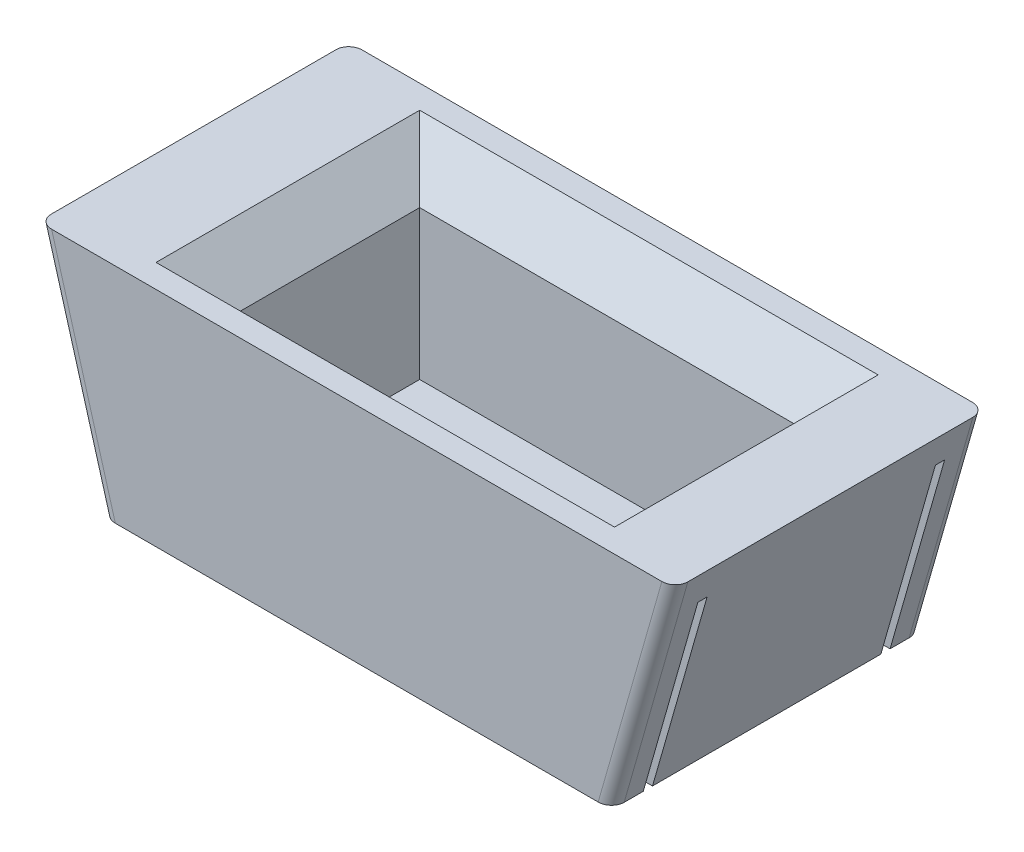
from build123d import *

# Parameters (mm, degrees)
SKETCH1_W           = 127
SKETCH1_H           = 61.9252
BOSS_EXTRUDE1_DEPTH = 44.45
SKETCH1_3_W         = 127
SKETCH1_3_H         = 1.8415
CUT_EXTRUDE2_DEPTH  = 38.1
SKETCH2_W           = 71.12
SKETCH2_H           = 32.258
SKETCH2_W_2         = 35.442647017
SKETCH2_H_2         = 23.182829488
CUT_EXTRUDE3_DEPTH  = 38.1
CHAMFER2_SIZE       = 10.16
CUT_EXTRUDE5_DEPTH  = 100.210800294
FILLET3_R           = 2.54
SKETCH2_3_W         = 35.442647017
SKETCH2_3_H         = 23.182829488
CUT_EXTRUDE6_DEPTH  = 84.466970107
CHAMFER3_SIZE       = 2.54
SKETCH9_W           = 74.62
SKETCH9_H           = 35.758
CUT_EXTRUDE7_DEPTH  = 38.1


with BuildPart() as part:
    # Sketch1 → Boss-Extrude1 (new body)
    with BuildSketch(Plane(origin=(0, 0, 0), x_dir=(1, 0, 0), z_dir=(0, 1, 0))):
        Rectangle(SKETCH1_W, SKETCH1_H)
    extrude(amount=BOSS_EXTRUDE1_DEPTH)

    # Sketch1<3> → Cut-Extrude2 (cut)
    with BuildSketch(Plane(origin=(0, 0, 0), x_dir=(1, 0, 0), z_dir=(0, 1, 0))):
        with Locations((0, 23.69185)):
            Rectangle(SKETCH1_3_W, SKETCH1_3_H)
        with Locations((0, -23.69185)):
            Rectangle(SKETCH1_3_W, SKETCH1_3_H)
    extrude(amount=CUT_EXTRUDE2_DEPTH, mode=Mode.SUBTRACT)

    # Sketch2 → Cut-Extrude3 (cut)
    with BuildSketch(Plane(origin=(0, 44.45, 0), x_dir=(1, 0, 0), z_dir=(0, 1, 0))):
        with Locations((1.016, 0)):
            Rectangle(SKETCH2_W, SKETCH2_H)
        with Locations((12.504676492, 0)):
            Rectangle(SKETCH2_W_2, SKETCH2_H_2, mode=Mode.SUBTRACT)
    extrude(amount=-CUT_EXTRUDE3_DEPTH, mode=Mode.SUBTRACT)

    # Chamfer2
    chamfer2_edges = [part.edges().sort_by_distance(p)[0] for p in [
        (36.576, 44.45, 0),
        (1.016, 44.45, -16.129),
        (-34.544, 44.45, 0),
        (1.016, 44.45, 16.129),
    ]]
    chamfer(chamfer2_edges, length=CHAMFER2_SIZE)

    # Sketch7 → Cut-Extrude5 (cut, through all)
    with BuildSketch(Plane.XY.offset(30.9626)):
        Polygon((-50.795476794, 0), (-63.5, 44.45), (-63.5, 0), align=None)
        Polygon((63.5, 44.45), (50.795476794, 0), (63.5, 0), align=None)
    extrude(amount=-CUT_EXTRUDE5_DEPTH, mode=Mode.SUBTRACT)

    # Fillet3
    fillet3_edges = [part.edges().sort_by_distance(p)[0] for p in [
        (-57.147738397, 22.225, -30.9626),
        (-57.147738397, 22.225, 30.9626),
        (57.147738397, 22.225, 30.9626),
        (57.147738397, 22.225, -30.9626),
    ]]
    fillet(fillet3_edges, radius=FILLET3_R)

    # Sketch2<3> → Cut-Extrude6 (cut, through all)
    with BuildSketch(Plane(origin=(0, 44.45, 0), x_dir=(1, 0, 0), z_dir=(0, 1, 0))):
        with Locations((12.504676492, 0)):
            Rectangle(SKETCH2_3_W, SKETCH2_3_H)
    extrude(amount=-CUT_EXTRUDE6_DEPTH, mode=Mode.SUBTRACT)

    # Chamfer3
    chamfer3_edges = [part.edges().sort_by_distance(p)[0] for p in [
        (30.226, 0, 0),
        (12.504676491, 0, 11.591414744),
        (-5.216647017, 0, 0),
        (12.504676491, 0, -11.591414744),
    ]]
    chamfer(chamfer3_edges, length=CHAMFER3_SIZE)

    # Sketch9 → Cut-Extrude7 (cut)
    with BuildSketch(Plane(origin=(0, 44.45, 0), x_dir=(1, 0, 0), z_dir=(0, 1, 0))):
        with Locations((1.016, 0)):
            Rectangle(SKETCH9_W, SKETCH9_H)
    extrude(amount=-CUT_EXTRUDE7_DEPTH, mode=Mode.SUBTRACT)


solid = part.part
